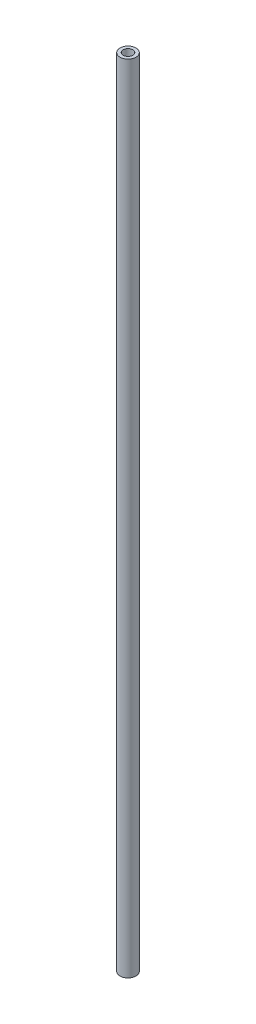
from build123d import *

# Parameters (mm, degrees)
SKETCH_1_R      = 5
SKETCH_1_R_2    = 3
EXTRUDE_1_DEPTH = 497


with BuildPart() as part:
    # Эскиз1 → Бобышка-Вытянуть1 (new body)
    with BuildSketch(Plane(origin=(0, 0, 0), x_dir=(1, 0, 0), z_dir=(0, 1, 0))):
        with Locations(Location((0, 0, 0), (0, 0, 90))):
            Circle(SKETCH_1_R)
        with Locations(Location((0, 0, 0), (0, 0, 90))):
            Circle(SKETCH_1_R_2, mode=Mode.SUBTRACT)
    extrude(amount=EXTRUDE_1_DEPTH)


solid = part.part
